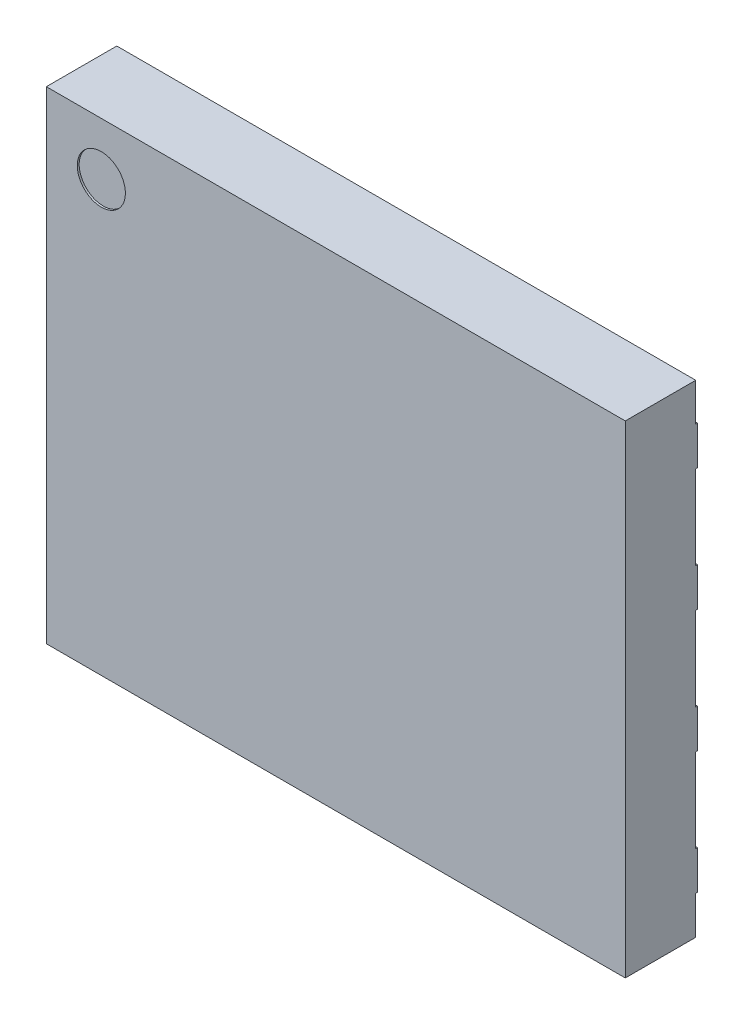
from build123d import *

# Parameters (mm, degrees)
BOSS_EXTRUDE1_START  = 0.02
SKETCH1_W            = 6
SKETCH1_H            = 5
BOSS_EXTRUDE1_DEPTH  = 0.73
BOSS_EXTRUDE2_DEPTH  = 0.02
LPATTERN1_COUNT      = 4
LPATTERN1_PITCH      = 1.27
MIRROR1_COPY_1_DEPTH = 0.02
MIRROR1_COPY_2_DEPTH = 0.02
MIRROR1_COPY_3_DEPTH = 0.02
BOSS_EXTRUDE3_DEPTH  = 0.02
SKETCH4_R            = 0.249386248
CUT_EXTRUDE1_DEPTH   = 0.02


with BuildPart() as part:
    # Sketch1 → Boss-Extrude1 (new body)
    with BuildSketch(Plane.XY.offset(BOSS_EXTRUDE1_START)):
        Rectangle(SKETCH1_W, SKETCH1_H)
    extrude(amount=BOSS_EXTRUDE1_DEPTH)

    # Sketch2 → Boss-Extrude2 (add)
    with BuildSketch(Plane(origin=(0, 0, 0.02), x_dir=(-1, 0, 0), z_dir=(0, 0, -1))):
        with BuildLine():
            Line((-3, 2.105), (-2.6, 2.105))
            ThreePointArc((-2.6, 2.105), (-2.4, 1.905), (-2.6, 1.705))
            Line((-2.6, 1.705), (-3, 1.705))
            Line((-3, 1.705), (-3, 2.105))
        make_face()
    boss_extrude2 = extrude(amount=BOSS_EXTRUDE2_DEPTH)

    # LPattern1: Boss-Extrude2 ×4
    with Locations(*[(0, -i * LPATTERN1_PITCH, 0) for i in range(1, LPATTERN1_COUNT)]):
        add(boss_extrude2)

    # Mirror1: Boss-Extrude2 across plane
    add(boss_extrude2.mirror(Plane(origin=(0, 0, 0), x_dir=(0, 0, 1), z_dir=(1, 0, 0))))

    # Mirror1 copy 1 sketch → Mirror1 copy 1 (add)
    with BuildSketch(Plane(origin=(0, -1.27, 0.02), x_dir=(1, 0, 0), z_dir=(0, 0, -1))):
        with BuildLine():
            Line((-3, -2.105), (-2.6, -2.105))
            ThreePointArc((-2.6, -2.105), (-2.4, -1.905), (-2.6, -1.705))
            Line((-2.6, -1.705), (-3, -1.705))
            Line((-3, -1.705), (-3, -2.105))
        make_face()
    extrude(amount=MIRROR1_COPY_1_DEPTH)

    # Mirror1 copy 2 sketch → Mirror1 copy 2 (add)
    with BuildSketch(Plane(origin=(0, -2.54, 0.02), x_dir=(1, 0, 0), z_dir=(0, 0, -1))):
        with BuildLine():
            Line((-3, -2.105), (-2.6, -2.105))
            ThreePointArc((-2.6, -2.105), (-2.4, -1.905), (-2.6, -1.705))
            Line((-2.6, -1.705), (-3, -1.705))
            Line((-3, -1.705), (-3, -2.105))
        make_face()
    extrude(amount=MIRROR1_COPY_2_DEPTH)

    # Mirror1 copy 3 sketch → Mirror1 copy 3 (add)
    with BuildSketch(Plane(origin=(0, -3.81, 0.02), x_dir=(1, 0, 0), z_dir=(0, 0, -1))):
        with BuildLine():
            Line((-3, -2.105), (-2.6, -2.105))
            ThreePointArc((-2.6, -2.105), (-2.4, -1.905), (-2.6, -1.705))
            Line((-2.6, -1.705), (-3, -1.705))
            Line((-3, -1.705), (-3, -2.105))
        make_face()
    extrude(amount=MIRROR1_COPY_3_DEPTH)

    # Sketch3 → Boss-Extrude3 (add)
    with BuildSketch(Plane(origin=(0, 0, 0.02), x_dir=(-1, 0, 0), z_dir=(0, 0, -1))):
        Polygon((1.7, 1.71562478), (1.26562478, 2.15), (-1.7, 2.15), (-1.7, -2.15), (1.7, -2.15), align=None)
    extrude(amount=BOSS_EXTRUDE3_DEPTH)

    # Sketch4 → Cut-Extrude1 (cut)
    with BuildSketch(Plane.XY.offset(0.75)):
        with Locations((-2.430272112, 1.952847144)):
            Circle(SKETCH4_R)
    extrude(amount=-CUT_EXTRUDE1_DEPTH, mode=Mode.SUBTRACT)


solid = part.part
